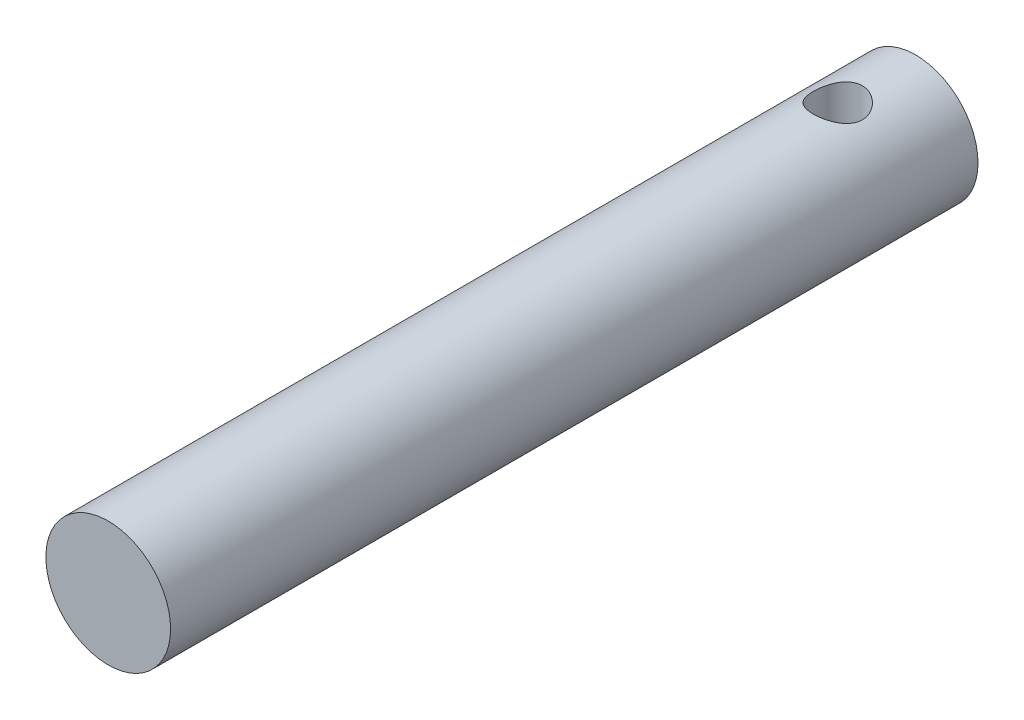
from build123d import *

# Parameters (mm, degrees)
ESBO_O1_R                              = 4
RESSALTO_EXTRUS_O1_DEPTH               = 51.8
CORTE_EXTRUS_O1_REACH                  = 54.108
CORTE_EXTRUS_O1_END_RADIUS             = 4
ESBO_O2_R                              = 1.575
CORTE_EXTRUS_O1_DIRECTION_2_REACH      = 54.108
CORTE_EXTRUS_O1_DIRECTION_2_END_RADIUS = 4


with BuildPart() as part:
    # Esboço1 → Ressalto-extrusão1 (new body)
    with BuildSketch(Plane.XY):
        with Locations(Location((0, 0, 0), (0, 0, 180))):
            Circle(ESBO_O1_R)
    extrude(amount=RESSALTO_EXTRUS_O1_DEPTH)

    # Corte-extrusão1: up to this cylinder (the profile starts inside it)
    corte_extrus_o1_end = Plane(origin=(0, 0, 5), z_dir=(0, 0, -1)) * Cylinder(CORTE_EXTRUS_O1_END_RADIUS, 117.216, mode=Mode.PRIVATE)
    # Esboço2 → Corte-extrusão1 (cut, up to the surface)
    with BuildSketch(Plane(origin=(0, 0, 0), x_dir=(1, 0, 0), z_dir=(0, 1, 0)), mode=Mode.PRIVATE) as corte_extrus_o1_sk1:
        with Locations(Location((0, -5, 0), (0, 0, 270))):
            Circle(ESBO_O2_R)
    corte_extrus_o1_tool1 = extrude(corte_extrus_o1_sk1.sketch, amount=-CORTE_EXTRUS_O1_REACH, mode=Mode.PRIVATE) & corte_extrus_o1_end
    add(corte_extrus_o1_tool1.solids().sort_by_distance((0, 0, 5))[0], mode=Mode.SUBTRACT)

    # Corte-extrusão1 direction 2: up to this cylinder (the profile starts inside it)
    corte_extrus_o1_direction_2_end = Plane(origin=(0, 0, 5), z_dir=(0, 0, -1)) * Cylinder(CORTE_EXTRUS_O1_DIRECTION_2_END_RADIUS, 117.216, mode=Mode.PRIVATE)
    # Esboço2 → Corte-extrusão1 direction 2 (cut, up to the surface)
    with BuildSketch(Plane(origin=(0, 0, 0), x_dir=(1, 0, 0), z_dir=(0, 1, 0)), mode=Mode.PRIVATE) as corte_extrus_o1_direction_2_sk1:
        with Locations(Location((0, -5, 0), (0, 0, 270))):
            Circle(ESBO_O2_R)
    corte_extrus_o1_direction_2_tool1 = extrude(corte_extrus_o1_direction_2_sk1.sketch, amount=CORTE_EXTRUS_O1_DIRECTION_2_REACH, mode=Mode.PRIVATE) & corte_extrus_o1_direction_2_end
    add(corte_extrus_o1_direction_2_tool1.solids().sort_by_distance((0, 0, 5))[0], mode=Mode.SUBTRACT)


solid = part.part
